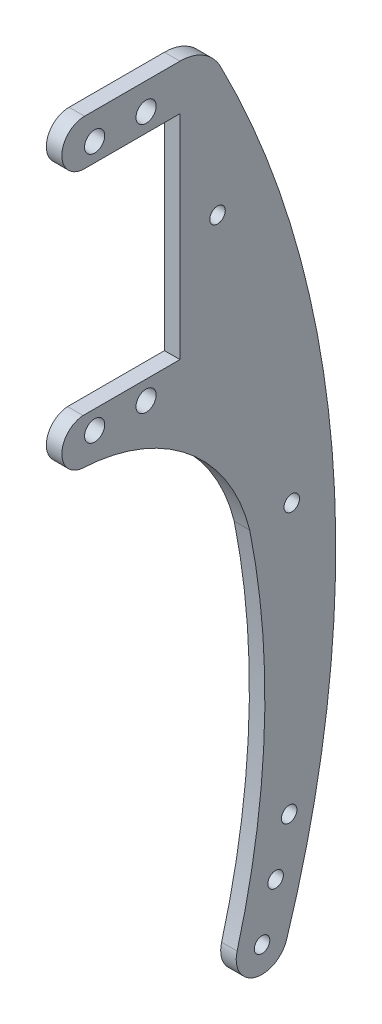
from build123d import *

# Parameters (mm, degrees)
SKETCH1_R           = 1.95
SKETCH1_R_2         = 1.5
BOSS_EXTRUDE1_DEPTH = 3


with BuildPart() as part:
    # Sketch1 → Boss-Extrude1 (new body)
    with BuildSketch(Plane(origin=(0, 0, 0), x_dir=(0, 0, -1), z_dir=(1, 0, 0))):
        with BuildLine():
            Line((-6.925, 29.4125), (11.525, 29.4125))
            ThreePointArc((11.525, 29.4125), (16.101209281, 28.129035679), (19.342554621, 24.653024687))
            ThreePointArc((19.342554621, 24.653024687), (40.969128184, -50.437912981), (32.171039161, -128.084234422))
            ThreePointArc((32.171039161, -128.084234422), (25.983785002, -131.35426762), (22.587628574, -125.235333672))
            ThreePointArc((22.587628574, -125.235333672), (27.867812209, -90.719506549), (25.024864397, -55.91806536))
            ThreePointArc((25.024864397, -55.91806536), (13.295850828, -37.309652467), (-7.219256672, -29.374089856))
            ThreePointArc((-7.219256672, -29.374089856), (-11.325, -24.983940313), (-7.219256672, -20.59379077))
            Line((-7.219256672, -20.59379077), (11.525, -20.59379077))
            Line((11.525, -20.59379077), (11.525, 20.6125))
            Line((11.525, 20.6125), (-6.925, 20.6125))
            ThreePointArc((-6.925, 20.6125), (-11.325, 25.0125), (-6.925, 29.4125))
        make_face()
        with Locations((-4.975, 24.2125)):
            Circle(SKETCH1_R, mode=Mode.SUBTRACT)
        with Locations(Location((4.975, 24.2125, 0), (0, 0, 180))):
            Circle(SKETCH1_R, mode=Mode.SUBTRACT)
        with Locations((4.975, -24.2125)):
            Circle(SKETCH1_R, mode=Mode.SUBTRACT)
        with Locations(Location((-4.975, -24.2125, 0), (0, 0, 180))):
            Circle(SKETCH1_R, mode=Mode.SUBTRACT)
        with Locations((18.795, 0)):
            Circle(SKETCH1_R_2, mode=Mode.SUBTRACT)
        with Locations((33.159858862, -55.41852876)):
            Circle(SKETCH1_R_2, mode=Mode.SUBTRACT)
        with Locations((32.663736784, -107.316157442)):
            Circle(SKETCH1_R_2, mode=Mode.SUBTRACT)
        with Locations((30.036135717, -116.938856525)):
            Circle(SKETCH1_R_2, mode=Mode.SUBTRACT)
        with Locations((27.408534649, -126.561555607)):
            Circle(SKETCH1_R_2, mode=Mode.SUBTRACT)
    extrude(amount=BOSS_EXTRUDE1_DEPTH)


solid = part.part
